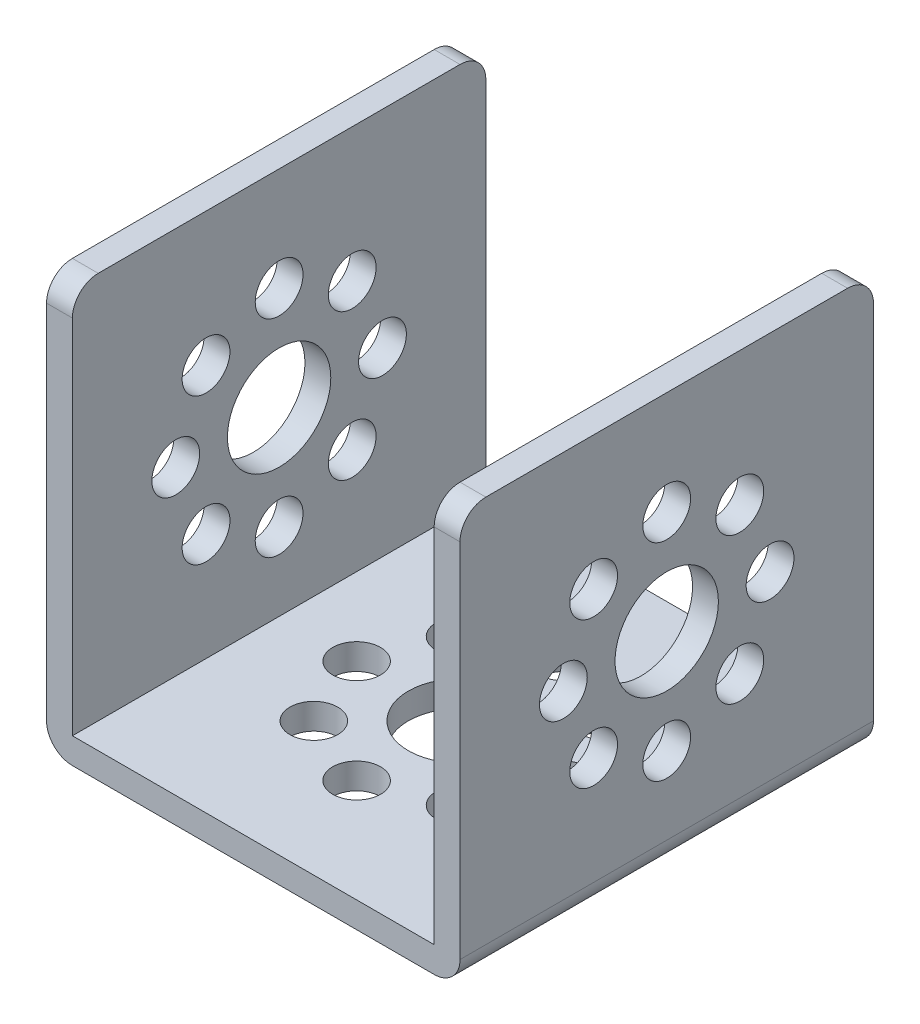
from build123d import *

# Parameters (mm, degrees)
BOSS_EXTRUDE1_DEPTH = 16
FILLET1_R           = 2
FILLET2_R           = 2
SKETCH5_R           = 4
SKETCH5_R_2         = 1.85
CUT_EXTRUDE1_DEPTH  = 32
SKETCH8_R           = 4
SKETCH8_R_2         = 1.85
CUT_EXTRUDE2_DEPTH  = 2


with BuildPart() as part:
    # Sketch3 → Boss-Extrude1 (new, symmetric)
    with BuildSketch(Plane.XY):
        with BuildLine():
            Line((-14, 0), (14, 0))
            ThreePointArc((14, 0), (15.414213562, 0.585786438), (16, 2))
            Line((16, 2), (16, 32))
            Line((16, 32), (14, 32))
            Line((14, 32), (14, 2))
            Line((14, 2), (-14, 2))
            Line((-14, 2), (-14, 32))
            Line((-14, 32), (-16, 32))
            Line((-16, 32), (-16, 2))
            ThreePointArc((-16, 2), (-15.414213562, 0.585786438), (-14, 0))
        make_face()
    extrude(amount=BOSS_EXTRUDE1_DEPTH, both=True)

    # Fillet1
    fillet1_edges = [part.edges().sort_by_distance(p)[0] for p in [
        (15, 32, 16),
        (15, 32, -16),
    ]]
    fillet(fillet1_edges, radius=FILLET1_R)

    # Fillet2
    fillet2_edges = [part.edges().sort_by_distance(p)[0] for p in [
        (-15, 32, -16),
        (-15, 32, 16),
    ]]
    fillet(fillet2_edges, radius=FILLET2_R)

    # Sketch5 → Cut-Extrude1 (cut)
    with BuildSketch(Plane(origin=(16, 0, 0), x_dir=(0, 0, -1), z_dir=(1, 0, 0))):
        with Locations((0, 16)):
            Circle(SKETCH5_R)
        with Locations((0, 8)):
            Circle(SKETCH5_R_2)
        with Locations((0, 24)):
            Circle(SKETCH5_R_2)
        with Locations((-8, 16)):
            Circle(SKETCH5_R_2)
        with Locations((8, 16)):
            Circle(SKETCH5_R_2)
        with Locations((5.656854249, 21.656854249)):
            Circle(SKETCH5_R_2)
        with Locations((-5.656854249, 21.656854249)):
            Circle(SKETCH5_R_2)
        with Locations((5.656854249, 10.343145751)):
            Circle(SKETCH5_R_2)
        with Locations((-5.656854249, 10.343145751)):
            Circle(SKETCH5_R_2)
    extrude(amount=-CUT_EXTRUDE1_DEPTH, mode=Mode.SUBTRACT)

    # Sketch8 → Cut-Extrude2 (cut)
    with BuildSketch(Plane(origin=(0, 2, 0), x_dir=(1, 0, 0), z_dir=(0, 1, 0))):
        with Locations(Location((0, 0, 0), (0, 0, 180))):
            Circle(SKETCH8_R)
        with Locations(Location((0, -8, 0), (0, 0, 180))):
            Circle(SKETCH8_R_2)
        with Locations(Location((0, 8, 0), (0, 0, 180))):
            Circle(SKETCH8_R_2)
        with Locations(Location((-8, 0, 0), (0, 0, 180))):
            Circle(SKETCH8_R_2)
        with Locations(Location((8, 0, 0), (0, 0, 180))):
            Circle(SKETCH8_R_2)
        with Locations(Location((5.656854249, 5.656854249, 0), (0, 0, 180))):
            Circle(SKETCH8_R_2)
        with Locations(Location((-5.656854249, 5.656854249, 0), (0, 0, 180))):
            Circle(SKETCH8_R_2)
        with Locations(Location((5.656854249, -5.656854249, 0), (0, 0, 180))):
            Circle(SKETCH8_R_2)
        with Locations(Location((-5.656854249, -5.656854249, 0), (0, 0, 180))):
            Circle(SKETCH8_R_2)
    extrude(amount=-CUT_EXTRUDE2_DEPTH, mode=Mode.SUBTRACT)


solid = part.part
